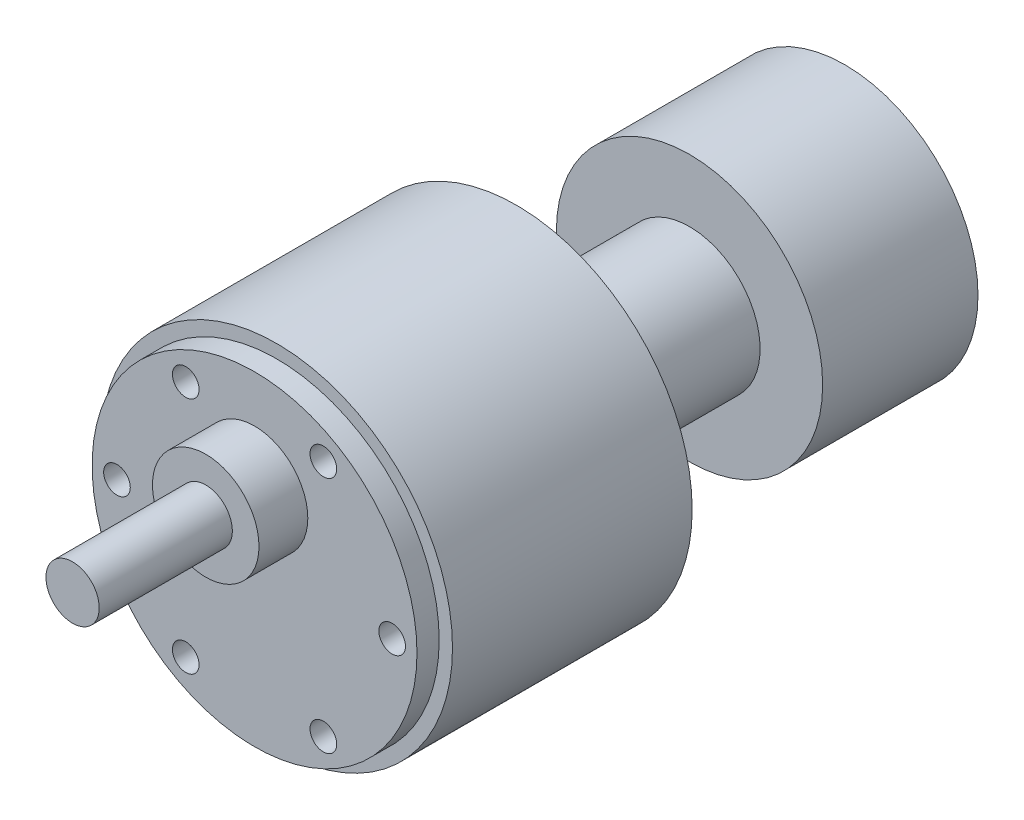
from build123d import *

# Parameters (mm, degrees)
SKETCH4_R           = 7.953728713
BOSS_EXTRUDE4_DEPTH = 33.25
SKETCH5_R           = 18.3
BOSS_EXTRUDE5_DEPTH = 2.5
SKETCH5_3_R         = 19.8
BOSS_EXTRUDE6_DEPTH = 27
SKETCH6_R           = 15
BOSS_EXTRUDE7_DEPTH = 17.5
SKETCH7_R           = 6
BOSS_EXTRUDE8_DEPTH = 5.5
SKETCH9_R           = 3
BOSS_EXTRUDE9_DEPTH = 15
SKETCH10_R          = 1.5
CUT_EXTRUDE1_DEPTH  = 4
CIRPATTERN1_COUNT   = 6


with BuildPart() as part:
    # Sketch4 → Boss-Extrude4 (new, symmetric)
    with BuildSketch(Plane.XY):
        Circle(SKETCH4_R)
    extrude(amount=BOSS_EXTRUDE4_DEPTH, both=True)

    # Sketch5 → Boss-Extrude5 (add)
    with BuildSketch(Plane.XY.offset(30.75)):
        Circle(SKETCH5_R)
    extrude(amount=BOSS_EXTRUDE5_DEPTH)

    # Sketch5<3> → Boss-Extrude6 (add)
    with BuildSketch(Plane.XY.offset(30.75)):
        Circle(SKETCH5_3_R)
    extrude(amount=-BOSS_EXTRUDE6_DEPTH)

    # Sketch6 → Boss-Extrude7 (add)
    with BuildSketch(Plane(origin=(0, 0, -33.25), x_dir=(-1, 0, 0), z_dir=(0, 0, -1))):
        Circle(SKETCH6_R)
    extrude(amount=-BOSS_EXTRUDE7_DEPTH)

    # Sketch7 → Boss-Extrude8 (add)
    with BuildSketch(Plane.XY.offset(33.25)):
        with Locations((0, 7)):
            Circle(SKETCH7_R)
    extrude(amount=BOSS_EXTRUDE8_DEPTH)

    # Sketch9 → Boss-Extrude9 (add)
    with BuildSketch(Plane.XY.offset(38.75)):
        with Locations((0, 7)):
            Circle(SKETCH9_R)
    extrude(amount=BOSS_EXTRUDE9_DEPTH)

    # Sketch10 → Cut-Extrude1 (cut)
    with BuildSketch(Plane.XY.offset(33.25)):
        with Locations((-15.5, 0)):
            Circle(SKETCH10_R)
    cut_extrude1 = extrude(amount=-CUT_EXTRUDE1_DEPTH, mode=Mode.SUBTRACT)

    # CirPattern1: Cut-Extrude1 ×6 about axis
    cirpattern1_axis = Axis((0, 0, 64.697513325), (0, 0, -1))
    for i in range(1, CIRPATTERN1_COUNT):
        add(cut_extrude1.rotate(cirpattern1_axis, i * 360 / CIRPATTERN1_COUNT), mode=Mode.SUBTRACT)


solid = part.part
